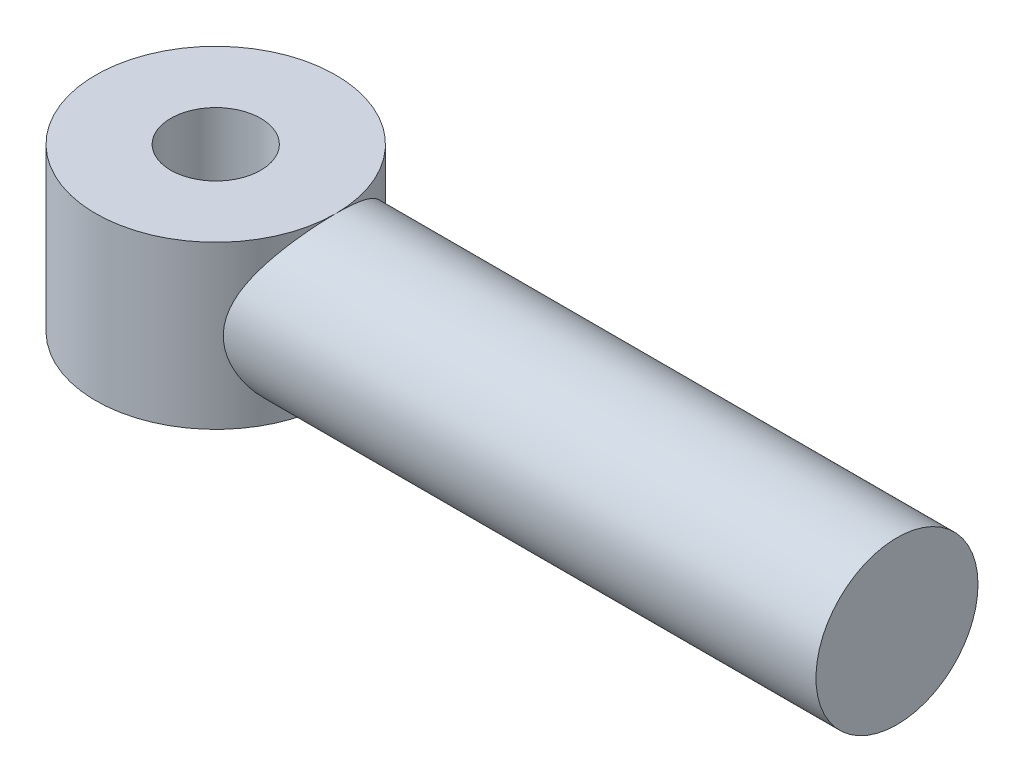
from build123d import *

# Parameters (mm, degrees)
SKETCH1_R                = 1.35
BOSS_EXTRUDE1_DEPTH      = 11.35
BOSS_EXTRUDE2_DEPTH      = 1.35
BOSS_EXTRUDE2_DEPTH_BACK = 1.35
SKETCH2_R                = 2
SKETCH3_R                = 0.75
CUT_EXTRUDE1_DEPTH       = 11.35


with BuildPart() as part:
    # Sketch1 → Boss-Extrude1 (new body)
    with BuildSketch(Plane(origin=(0, 0, 0), x_dir=(0, 0, -1), z_dir=(1, 0, 0))):
        Circle(SKETCH1_R)
    extrude(amount=BOSS_EXTRUDE1_DEPTH)

    # Sketch2 → Boss-Extrude2 (add, two sides: drawn at the far end of the back side and taken through both)
    with BuildSketch(Plane(origin=(0, 0, 0), x_dir=(1, 0, 0), z_dir=(0, 1, 0)).offset(-BOSS_EXTRUDE2_DEPTH_BACK)):
        Circle(SKETCH2_R)
    extrude(amount=BOSS_EXTRUDE2_DEPTH + BOSS_EXTRUDE2_DEPTH_BACK)

    # Sketch3 → Cut-Extrude1 (cut)
    with BuildSketch(Plane(origin=(0, 1.35, 0), x_dir=(1, 0, 0), z_dir=(0, 1, 0))):
        Circle(SKETCH3_R)
    extrude(amount=-CUT_EXTRUDE1_DEPTH, mode=Mode.SUBTRACT)


solid = part.part
